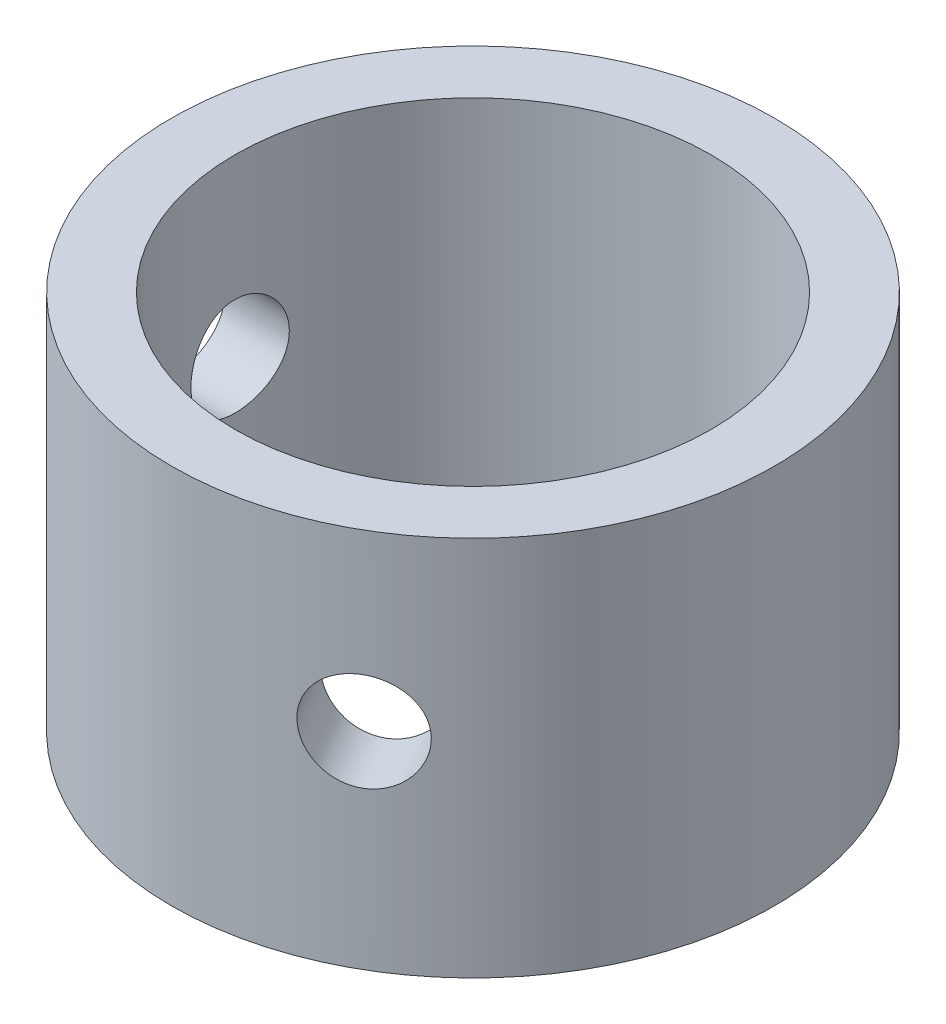
from build123d import *

# Parameters (mm, degrees)
SKETCH_1_R               = 9.5
SKETCH_1_R_2             = 7.5
EXTRUDE_1_DEPTH          = 12
CUT_EXTRUDE_1_REACH      = 20.014
CUT_EXTRUDE_1_END_RADIUS = 9.5
SKETCH_2_R               = 1.55
PATTERN_CIRCULAR_1_COUNT = 3


with BuildPart() as part:
    # 草图1 → 凸台-拉伸1 (new body)
    with BuildSketch(Plane(origin=(0, 0, 0), x_dir=(1, 0, 0), z_dir=(0, 1, 0))):
        with Locations(Location((0, 0, 0), (0, 0, 270))):
            Circle(SKETCH_1_R)
        with Locations(Location((0, 0, 0), (0, 0, 270))):
            Circle(SKETCH_1_R_2, mode=Mode.SUBTRACT)
    extrude(amount=EXTRUDE_1_DEPTH)

    # 切除-拉伸1: up to this cylinder (the profile starts inside it)
    cut_extrude_1_end = Plane(origin=(0, 6.5, 0), z_dir=(0, -1, 0)) * Cylinder(CUT_EXTRUDE_1_END_RADIUS, 60.028, mode=Mode.PRIVATE)
    # 草图2 → 切除-拉伸1 (cut, up to the surface)
    with BuildSketch(Plane(origin=(0, 0, 0), x_dir=(0, 0, -1), z_dir=(1, 0, 0)), mode=Mode.PRIVATE) as cut_extrude_1_sk1:
        with Locations((0, 6.5)):
            Circle(SKETCH_2_R)
    cut_extrude_1_tool1 = extrude(cut_extrude_1_sk1.sketch, amount=-CUT_EXTRUDE_1_REACH, mode=Mode.PRIVATE) & cut_extrude_1_end
    cut_extrude_1 = cut_extrude_1_tool1.solids().sort_by_distance((0, 6.5, 0))[0]
    add(cut_extrude_1, mode=Mode.SUBTRACT)

    # 阵列(圆周)1: 切除-拉伸1 ×3 about axis
    pattern_circular_1_axis = Axis((0, 12, 0), (0, 1, 0))
    for i in range(1, PATTERN_CIRCULAR_1_COUNT):
        add(cut_extrude_1.rotate(pattern_circular_1_axis, i * 360 / PATTERN_CIRCULAR_1_COUNT), mode=Mode.SUBTRACT)


solid = part.part
